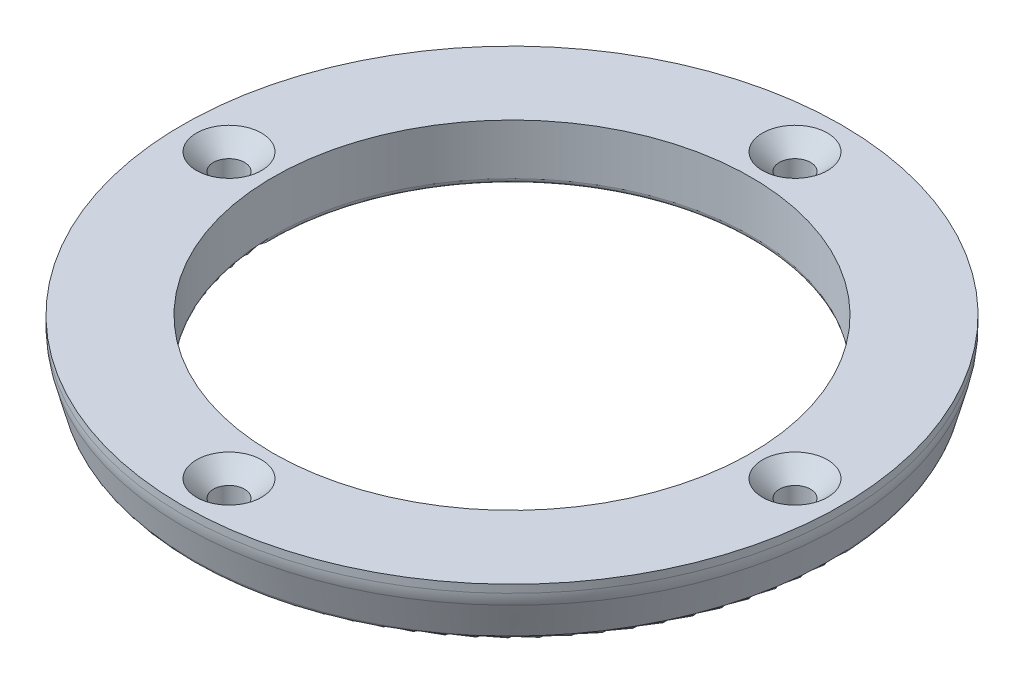
from build123d import *

# Parameters (mm, degrees)
SKETCH1_R                                       = 47.244
SKETCH1_R_2                                     = 34.544
BOSS_EXTRUDE1_DEPTH                             = 8.128
CSK_FOR_M4_FLAT_HEAD_MACHINE_SCREW1_D           = 4.5
CSK_FOR_M4_FLAT_HEAD_MACHINE_SCREW1_CSINK_D     = 9.4
CSK_FOR_M4_FLAT_HEAD_MACHINE_SCREW1_CSINK_ANGLE = 90
CIRPATTERN1_COUNT                               = 4
DRAFT2_ANGLE                                    = 15
SKETCH6_OUTSIDE_W                               = 125.592
SKETCH6_OUTSIDE_H                               = 125.592
SKETCH6_OUTSIDE_R                               = 47.622724369
CUT_EXTRUDE1_DEPTH                              = 69.580417064
FILLET1_R                                       = 6.35
FILLET2_R                                       = 0.79375


with BuildPart() as part:
    # Sketch1 → Boss-Extrude1 (new body)
    with BuildSketch(Plane(origin=(0, 0, 0), x_dir=(1, 0, 0), z_dir=(0, 1, 0))):
        with Locations(Location((0, 0, 0), (0, 0, 270))):
            Circle(SKETCH1_R)
        with Locations(Location((0, 0, 0), (0, 0, 270))):
            Circle(SKETCH1_R_2, mode=Mode.SUBTRACT)
    extrude(amount=BOSS_EXTRUDE1_DEPTH)

    # CSK for M4 Flat Head Machine Screw1 (through all)
    with Locations(Plane(origin=(0, 8.128, -40.894), x_dir=(0, 0, 1), z_dir=(0, 1, 0))):
        with Locations((0, 0)):
            csk_for_m4_flat_head_machine_screw1 = CounterSinkHole(CSK_FOR_M4_FLAT_HEAD_MACHINE_SCREW1_D / 2, CSK_FOR_M4_FLAT_HEAD_MACHINE_SCREW1_CSINK_D / 2, counter_sink_angle=CSK_FOR_M4_FLAT_HEAD_MACHINE_SCREW1_CSINK_ANGLE)

    # CirPattern1: CSK for M4 Flat Head Machine Screw1 ×4 about axis
    cirpattern1_axis = Axis((0, 0, 0), (0, 1, 0))
    for i in range(1, CIRPATTERN1_COUNT):
        add(csk_for_m4_flat_head_machine_screw1.rotate(cirpattern1_axis, i * 360 / CIRPATTERN1_COUNT), mode=Mode.SUBTRACT)

    # Draft2
    draft2_faces = [part.faces().sort_by_distance(p)[0] for p in [
        (0, 4.064, -47.244),
    ]]
    draft(draft2_faces, Plane(origin=(0, 0, 0), x_dir=(0, 0, -1), z_dir=(0, -1, 0)), DRAFT2_ANGLE)

    # Sketch5 → Cut-Revolve1 (revolve, cut)
    with BuildSketch(Plane(origin=(0, 0, 0), x_dir=(0, 0, -1), z_dir=(1, 0, 0)), mode=Mode.PRIVATE) as cut_revolve1_sk:
        Polygon((48.151891036, 8.128), (49.421891036, 8.128), (47.244, 0), (45.974, 0), align=None)
    revolve(cut_revolve1_sk.sketch.rotate(Axis((0, 8.128, 0), (0, -1, 0)), 180), axis=Axis((0, 8.128, 0), (0, -1, 0)), mode=Mode.SUBTRACT)

    # Sketch6 outside → Cut-Extrude1 (cut, through all)
    with BuildSketch(Plane(origin=(0, 8.128, 0), x_dir=(1, 0, 0), z_dir=(0, 1, 0))):
        Rectangle(SKETCH6_OUTSIDE_W, SKETCH6_OUTSIDE_H)
        with Locations(Location((0, 0, 0), (0, 0, 270))):
            Circle(SKETCH6_OUTSIDE_R, mode=Mode.SUBTRACT)
    extrude(amount=-CUT_EXTRUDE1_DEPTH, mode=Mode.SUBTRACT)

    # Fillet1
    fillet1_edges = [part.edges().sort_by_distance(p)[0] for p in [
        (0, 6.153123114, -47.622724369),
    ]]
    fillet(fillet1_edges, radius=FILLET1_R)

    # Fillet2
    fillet2_edges = [part.edges().sort_by_distance(p)[0] for p in [
        (0, 0, -45.974),
        (0, 0, -34.544),
    ]]
    fillet(fillet2_edges, radius=FILLET2_R)


solid = part.part
